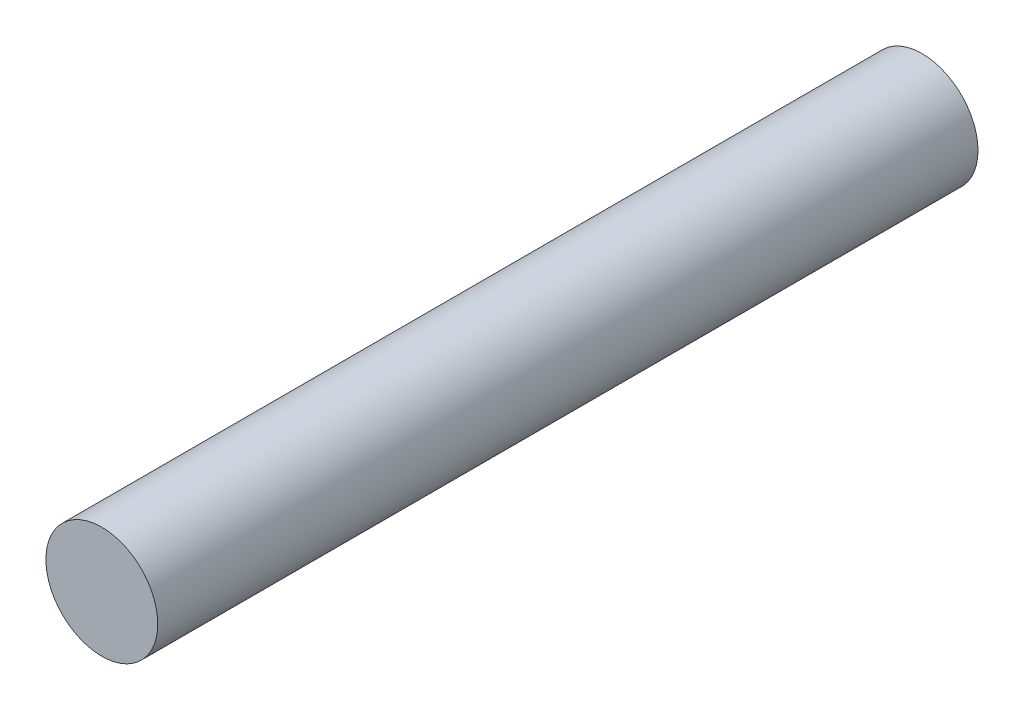
from build123d import *

# Parameters (mm, degrees)
ESQUISSE1_R        = 15
BOSS_EXTRU_1_DEPTH = 220


with BuildPart() as part:
    # Esquisse1 → Boss.-Extru.1 (new body)
    with BuildSketch(Plane.XY):
        Circle(ESQUISSE1_R)
    extrude(amount=BOSS_EXTRU_1_DEPTH)


solid = part.part
